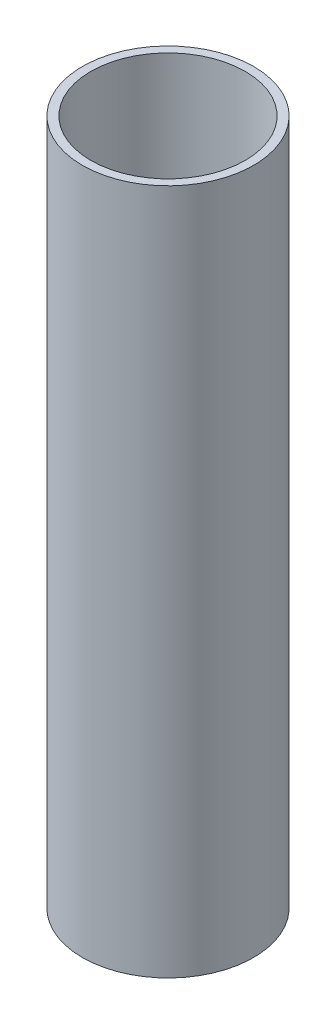
from build123d import *

# Parameters (mm, degrees)
SKETCH1_R           = 50.734897929
SKETCH1_R_2         = 45.72
BOSS_EXTRUDE1_DEPTH = 406.4


with BuildPart() as part:
    # Sketch1 → Boss-Extrude1 (new body)
    with BuildSketch(Plane(origin=(0, 0, 0), x_dir=(1, 0, 0), z_dir=(0, 1, 0))):
        with Locations(Location((0, 0, 0), (0, 0, 270))):
            Circle(SKETCH1_R)
        with Locations(Location((0, 0, 0), (0, 0, 270))):
            Circle(SKETCH1_R_2, mode=Mode.SUBTRACT)
    extrude(amount=BOSS_EXTRUDE1_DEPTH)


solid = part.part
